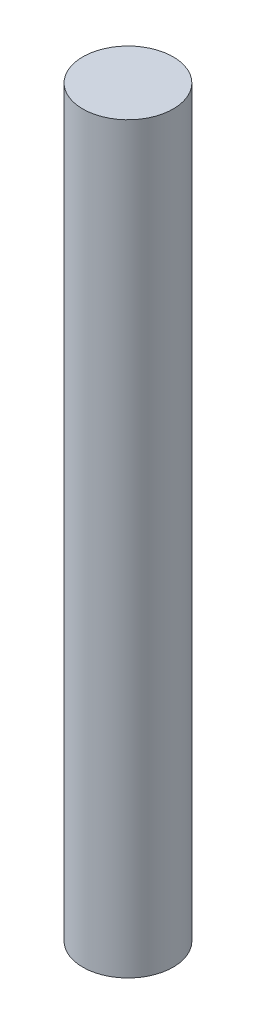
from build123d import *

# Parameters (mm, degrees)
SKETCH1_R           = 2.25
BOSS_EXTRUDE1_DEPTH = 37


with BuildPart() as part:
    # Sketch1 → Boss-Extrude1 (new body)
    with BuildSketch(Plane(origin=(0, 0, 0), x_dir=(1, 0, 0), z_dir=(0, 1, 0))):
        with Locations(Location((0, 0, 0), (0, 0, 270))):
            Circle(SKETCH1_R)
    extrude(amount=BOSS_EXTRUDE1_DEPTH)


solid = part.part
